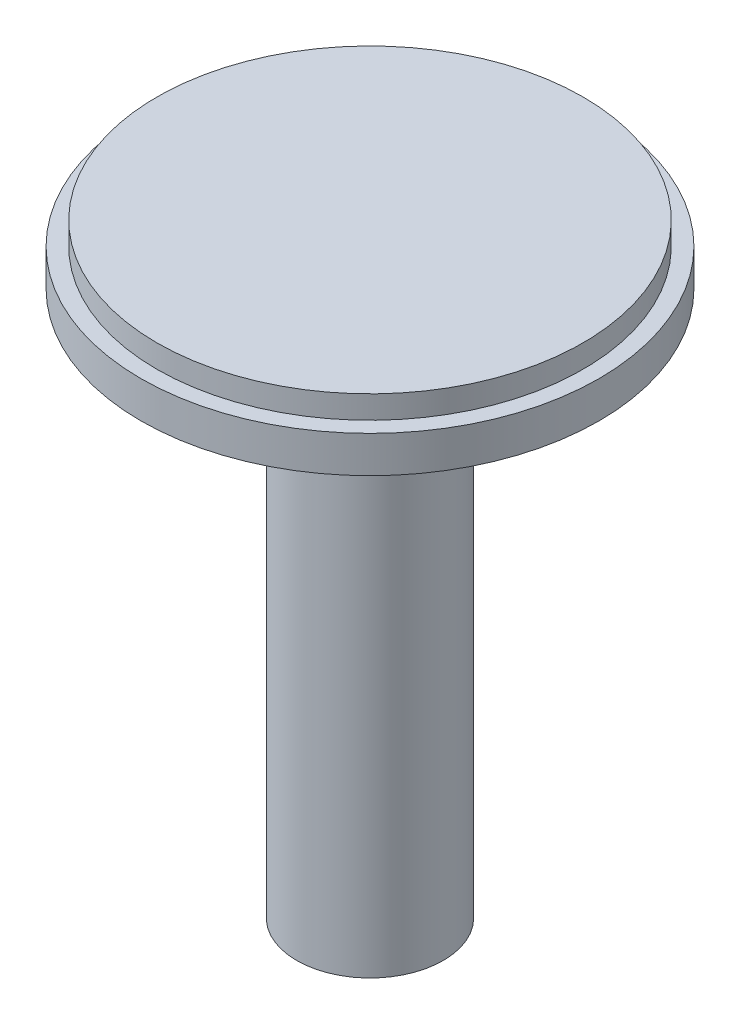
from build123d import *

# Parameters (mm, degrees)
SKETCH1_R           = 16
BOSS_EXTRUDE1_DEPTH = 119
SKETCH2_R           = 50
BOSS_EXTRUDE2_DEPTH = 8
SKETCH3_R           = 46.5
BOSS_EXTRUDE3_DEPTH = 5


with BuildPart() as part:
    # Sketch1 → Boss-Extrude1 (new body)
    with BuildSketch(Plane(origin=(0, 0, 0), x_dir=(1, 0, 0), z_dir=(0, 1, 0))):
        with Locations(Location((0, 0, 0), (0, 0, 270))):
            Circle(SKETCH1_R)
    extrude(amount=BOSS_EXTRUDE1_DEPTH)

    # Sketch2 → Boss-Extrude2 (add)
    with BuildSketch(Plane(origin=(0, 119, 0), x_dir=(1, 0, 0), z_dir=(0, 1, 0))):
        with Locations(Location((0, 0, 0), (0, 0, 270))):
            Circle(SKETCH2_R)
    extrude(amount=BOSS_EXTRUDE2_DEPTH)

    # Sketch3 → Boss-Extrude3 (add)
    with BuildSketch(Plane(origin=(0, 127, 0), x_dir=(1, 0, 0), z_dir=(0, 1, 0))):
        with Locations(Location((0, 0, 0), (0, 0, 270))):
            Circle(SKETCH3_R)
    extrude(amount=BOSS_EXTRUDE3_DEPTH)


solid = part.part
